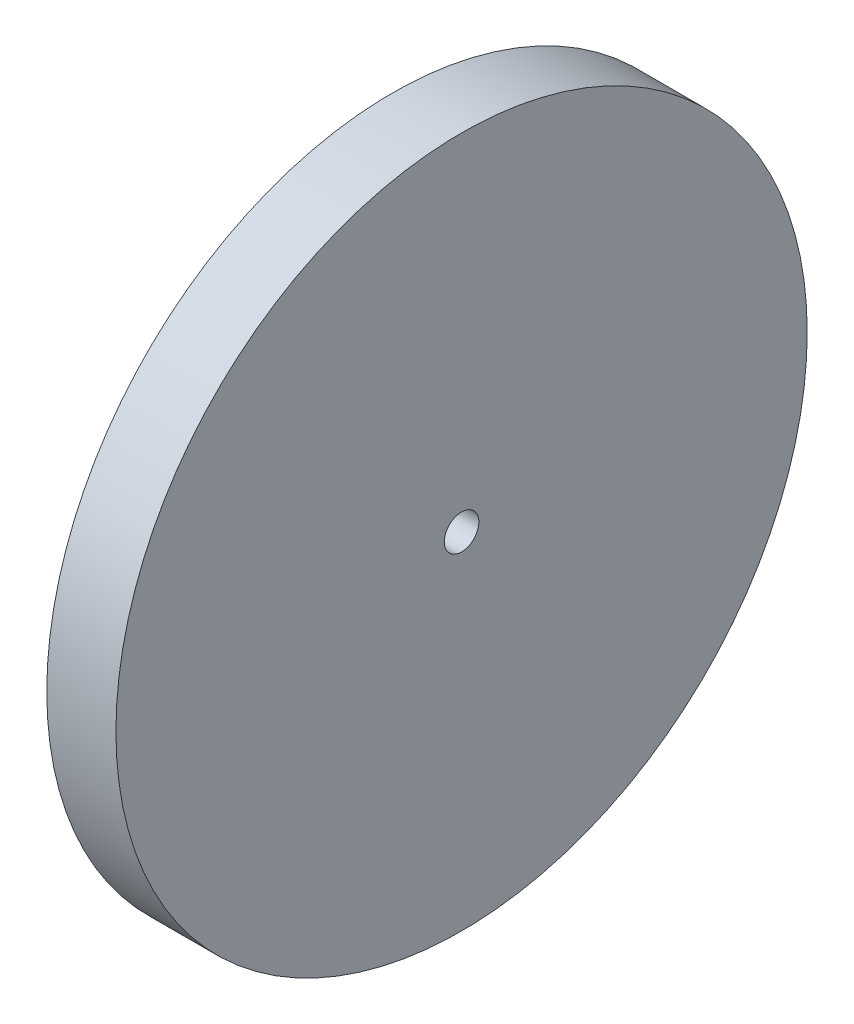
from build123d import *

# Parameters (mm, degrees)
BOSS_EXTRU_1_DEPTH      = 5
BOSS_EXTRU_1_DEPTH_BACK = 5
ESQUISSE1_R             = 50
ESQUISSE3_R             = 2.5
ENL_V_MAT_EXTRU_2_DEPTH = 72.414284285


with BuildPart() as part:
    # Esquisse1 → Boss.-Extru.1 (new, two sides: drawn at the far end of the back side and taken through both)
    with BuildSketch(Plane(origin=(0, 0, 0), x_dir=(0, 0, -1), z_dir=(1, 0, 0)).offset(-BOSS_EXTRU_1_DEPTH_BACK)):
        Circle(ESQUISSE1_R)
    extrude(amount=BOSS_EXTRU_1_DEPTH + BOSS_EXTRU_1_DEPTH_BACK)

    # Esquisse3 → Enlèv. mat.-Extru.2 (cut, through all)
    with BuildSketch(Plane(origin=(5, 0, 0), x_dir=(0, 0, -1), z_dir=(1, 0, 0))):
        Circle(ESQUISSE3_R)
    extrude(amount=-ENL_V_MAT_EXTRU_2_DEPTH, mode=Mode.SUBTRACT)


solid = part.part
